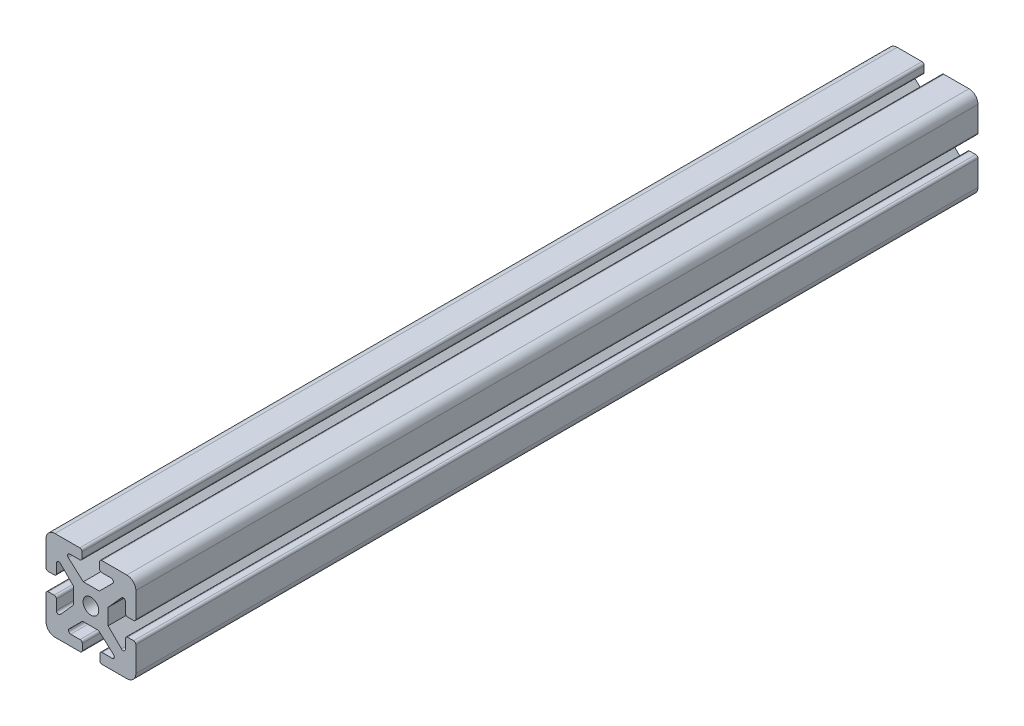
from build123d import *

# Parameters (mm, degrees)
SKETCH2_R           = 3.492543695
BOSS_EXTRUDE1_DEPTH = 375


with BuildPart() as part:
    # Sketch2 → Boss-Extrude1 (new body)
    with BuildSketch(Plane.XY):
        with BuildLine():
            Line((19.48831917, 27.684671829), (23.749889801, 27.684671829))
            Line((23.749889801, 27.684671829), (29.699681879, 33.624984685))
            ThreePointArc((29.699681879, 33.624984685), (29.917171057, 34.714970099), (28.993139054, 35.332654972))
            Line((28.993139054, 35.332654972), (24.845630957, 35.332654972))
            ThreePointArc((24.845630957, 35.332654972), (24.138524175, 35.625548191), (23.845630957, 36.332654972))
            Line((23.845630957, 36.332654972), (23.845630957, 39))
            ThreePointArc((23.845630957, 39), (24.138524175, 39.707106781), (24.845630957, 40))
            Line((24.845630957, 40), (36, 40))
            ThreePointArc((36, 40), (38.828427125, 38.828427125), (40, 36))
            Line((40, 36), (40, 24.961087436))
            ThreePointArc((40, 24.961087436), (39.707106781, 24.253980655), (39, 23.961087436))
            Line((39, 23.961087436), (36.388269628, 23.961087436))
            ThreePointArc((36.388269628, 23.961087436), (35.681162846, 24.253980655), (35.388269628, 24.961087436))
            Line((35.388269628, 24.961087436), (35.388269628, 29.408620307))
            ThreePointArc((35.388269628, 29.408620307), (34.744223919, 30.343123673), (33.641676542, 30.073901274))
            Line((33.641676542, 30.073901274), (27.684671829, 23.388818206))
            Line((27.684671829, 23.388818206), (27.684671829, 20.51168083))
            Line((27.684671829, 20.51168083), (27.684671829, 16.250110199))
            Line((27.684671829, 16.250110199), (33.624984685, 10.300318121))
            ThreePointArc((33.624984685, 10.300318121), (34.714970099, 10.082828943), (35.332654972, 11.006860946))
            Line((35.332654972, 11.006860946), (35.332654972, 15.154369043))
            ThreePointArc((35.332654972, 15.154369043), (35.625548191, 15.861475825), (36.332654972, 16.154369043))
            Line((36.332654972, 16.154369043), (39, 16.154369043))
            ThreePointArc((39, 16.154369043), (39.707106781, 15.861475825), (40, 15.154369043))
            Line((40, 15.154369043), (40, 4))
            ThreePointArc((40, 4), (38.828427125, 1.171572875), (36, 0))
            Line((36, 0), (24.961087436, 0))
            ThreePointArc((24.961087436, 0), (24.253980655, 0.292893219), (23.961087436, 1))
            Line((23.961087436, 1), (23.961087436, 3.611730372))
            ThreePointArc((23.961087436, 3.611730372), (24.253980655, 4.318837154), (24.961087436, 4.611730372))
            Line((24.961087436, 4.611730372), (29.408620307, 4.611730372))
            ThreePointArc((29.408620307, 4.611730372), (30.343123673, 5.255776081), (30.073901274, 6.358323458))
            Line((30.073901274, 6.358323458), (23.388818206, 12.315328171))
            Line((23.388818206, 12.315328171), (20.51168083, 12.315328171))
            Line((20.51168083, 12.315328171), (16.250110199, 12.315328171))
            Line((16.250110199, 12.315328171), (10.300318121, 6.375015315))
            ThreePointArc((10.300318121, 6.375015315), (10.082828943, 5.285029901), (11.006860946, 4.667345028))
            Line((11.006860946, 4.667345028), (15.154369043, 4.667345028))
            ThreePointArc((15.154369043, 4.667345028), (15.861475825, 4.374451809), (16.154369043, 3.667345028))
            Line((16.154369043, 3.667345028), (16.154369043, 1))
            ThreePointArc((16.154369043, 1), (15.861475825, 0.292893219), (15.154369043, 0))
            Line((15.154369043, 0), (4, 0))
            ThreePointArc((4, 0), (1.171572875, 1.171572875), (0, 4))
            Line((0, 4), (0, 15.038912564))
            ThreePointArc((0, 15.038912564), (0.292893219, 15.746019345), (1, 16.038912564))
            Line((1, 16.038912564), (3.611730372, 16.038912564))
            ThreePointArc((3.611730372, 16.038912564), (4.318837154, 15.746019345), (4.611730372, 15.038912564))
            Line((4.611730372, 15.038912564), (4.611730372, 10.591379693))
            ThreePointArc((4.611730372, 10.591379693), (5.255776081, 9.656876327), (6.358323458, 9.926098726))
            Line((6.358323458, 9.926098726), (12.315328171, 16.611181794))
            Line((12.315328171, 16.611181794), (12.315328171, 19.48831917))
            Line((12.315328171, 19.48831917), (12.315328171, 23.749889801))
            Line((12.315328171, 23.749889801), (6.375015315, 29.699681879))
            ThreePointArc((6.375015315, 29.699681879), (5.285029901, 29.917171057), (4.667345028, 28.993139054))
            Line((4.667345028, 28.993139054), (4.667345028, 24.845630957))
            ThreePointArc((4.667345028, 24.845630957), (4.374451809, 24.138524175), (3.667345028, 23.845630957))
            Line((3.667345028, 23.845630957), (1, 23.845630957))
            ThreePointArc((1, 23.845630957), (0.292893219, 24.138524175), (0, 24.845630957))
            Line((0, 24.845630957), (0, 36))
            ThreePointArc((0, 36), (1.171572875, 38.828427125), (4, 40))
            Line((4, 40), (15.038912564, 40))
            ThreePointArc((15.038912564, 40), (15.746019345, 39.707106781), (16.038912564, 39))
            Line((16.038912564, 39), (16.038912564, 36.388269628))
            ThreePointArc((16.038912564, 36.388269628), (15.746019345, 35.681162846), (15.038912564, 35.388269628))
            Line((15.038912564, 35.388269628), (10.591379693, 35.388269628))
            ThreePointArc((10.591379693, 35.388269628), (9.656876327, 34.744223919), (9.926098726, 33.641676542))
            Line((9.926098726, 33.641676542), (16.611181794, 27.684671829))
            Line((16.611181794, 27.684671829), (19.48831917, 27.684671829))
        make_face()
        with Locations((20, 20)):
            Circle(SKETCH2_R, mode=Mode.SUBTRACT)
    extrude(amount=BOSS_EXTRUDE1_DEPTH)


solid = part.part
